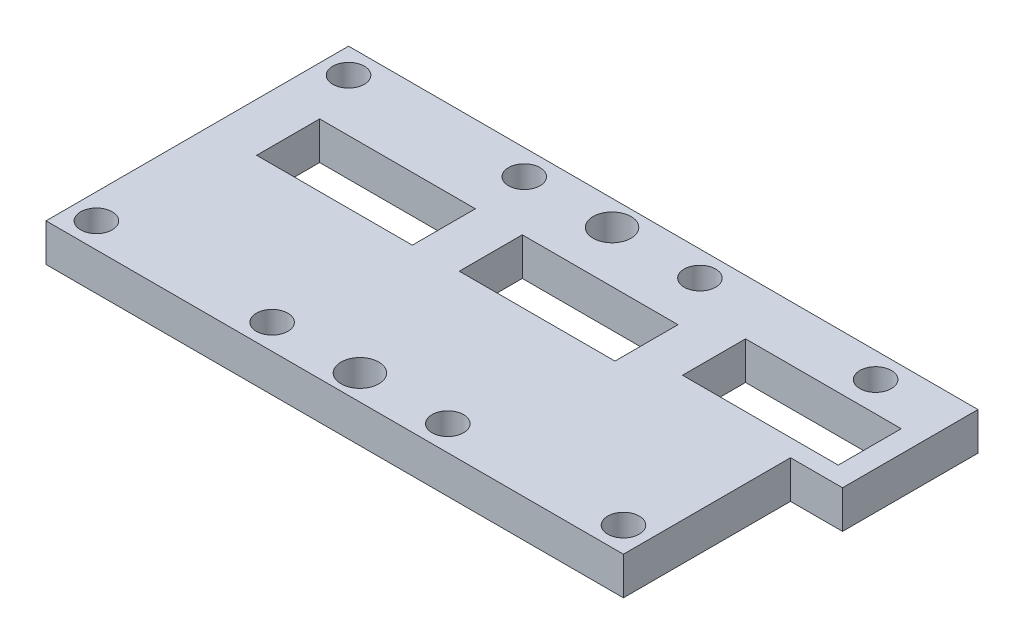
from build123d import *

# Parameters (mm, degrees)
SKETCH1_W           = 229
SKETCH1_H           = 120
BOSS_EXTRUDE1_DEPTH = 15
SKETCH2_W           = 20.632503002
SKETCH2_H           = 53.730004003
BOSS_EXTRUDE2_DEPTH = 15
CUT_EXTRUDE1_REACH  = 239.205
SKETCH3_W           = 61.75
SKETCH3_H           = 25
CUT_EXTRUDE2_REACH  = 239.205
SKETCH4_W           = 61.75
SKETCH4_H           = 25
CUT_EXTRUDE3_REACH  = 239.205
SKETCH5_W           = 61.75
SKETCH5_H           = 25
CUT_EXTRUDE5_REACH  = 239.205
SKETCH7_R           = 7.5
CUT_EXTRUDE7_REACH  = 239.205
SKETCH14_R          = 6.25


with BuildPart() as part:
    # Sketch1 → Boss-Extrude1 (new body)
    with BuildSketch(Plane(origin=(0, 0, 0), x_dir=(1, 0, 0), z_dir=(0, 1, 0))):
        with Locations((-114.5, 0)):
            Rectangle(SKETCH1_W, SKETCH1_H)
    extrude(amount=-BOSS_EXTRUDE1_DEPTH)

    # Sketch2 → Boss-Extrude2 (add)
    with BuildSketch(Plane(origin=(0, 0, 0), x_dir=(1, 0, 0), z_dir=(0, 1, 0))):
        with Locations((10.316251501, 33.134997999)):
            Rectangle(SKETCH2_W, SKETCH2_H)
    extrude(amount=-BOSS_EXTRUDE2_DEPTH)

    # Sketch3 → Cut-Extrude1 (cut, up to next)
    with BuildSketch(Plane(origin=(0, 0, 0), x_dir=(1, 0, 0), z_dir=(0, 1, 0)), mode=Mode.PRIVATE) as cut_extrude1_sk1:
        with Locations((-18.875, 25.691000385)):
            Rectangle(SKETCH3_W, SKETCH3_H)
    cut_extrude1_tool1 = extrude(cut_extrude1_sk1.sketch, amount=-CUT_EXTRUDE1_REACH, mode=Mode.PRIVATE) & part.part
    add(cut_extrude1_tool1.solids().sort_by_distance((-18.875, 0, -25.691))[0], mode=Mode.SUBTRACT)

    # Sketch4 → Cut-Extrude2 (cut, up to next)
    with BuildSketch(Plane(origin=(0, 0, 0), x_dir=(1, 0, 0), z_dir=(0, 1, 0)), mode=Mode.PRIVATE) as cut_extrude2_sk1:
        with Locations((-98.875, 17.152366083)):
            Rectangle(SKETCH4_W, SKETCH4_H)
    cut_extrude2_tool1 = extrude(cut_extrude2_sk1.sketch, amount=-CUT_EXTRUDE2_REACH, mode=Mode.PRIVATE) & part.part
    add(cut_extrude2_tool1.solids().sort_by_distance((-98.875, 0, -17.152366))[0], mode=Mode.SUBTRACT)

    # Sketch5 → Cut-Extrude3 (cut, up to next)
    with BuildSketch(Plane(origin=(0, 0, 0), x_dir=(1, 0, 0), z_dir=(0, 1, 0)), mode=Mode.PRIVATE) as cut_extrude3_sk1:
        with Locations((-178.875, 16.78)):
            Rectangle(SKETCH5_W, SKETCH5_H)
    cut_extrude3_tool1 = extrude(cut_extrude3_sk1.sketch, amount=-CUT_EXTRUDE3_REACH, mode=Mode.PRIVATE) & part.part
    add(cut_extrude3_tool1.solids().sort_by_distance((-178.875, 0, -16.78))[0], mode=Mode.SUBTRACT)

    # Sketch7 → Cut-Extrude5 (cut, up to next)
    with BuildSketch(Plane(origin=(0, 0, 0), x_dir=(1, 0, 0), z_dir=(0, 1, 0)), mode=Mode.PRIVATE) as cut_extrude5_sk1:
        with Locations(Location((-114.5, 50, 0), (0, 0, 270))):
            Circle(SKETCH7_R)
    cut_extrude5_tool1 = extrude(cut_extrude5_sk1.sketch, amount=-CUT_EXTRUDE5_REACH, mode=Mode.PRIVATE) & part.part
    # Sketch7 → Cut-Extrude5 (cut, up to next)
    with BuildSketch(Plane(origin=(0, 0, 0), x_dir=(1, 0, 0), z_dir=(0, 1, 0)), mode=Mode.PRIVATE) as cut_extrude5_sk2:
        with Locations(Location((-114.5, -50, 0), (0, 0, 270))):
            Circle(SKETCH7_R)
    cut_extrude5_tool2 = extrude(cut_extrude5_sk2.sketch, amount=-CUT_EXTRUDE5_REACH, mode=Mode.PRIVATE) & part.part
    add(cut_extrude5_tool1.solids().sort_by_distance((-114.5, 0, -50))[0], mode=Mode.SUBTRACT)
    add(cut_extrude5_tool2.solids().sort_by_distance((-114.5, 0, 50))[0], mode=Mode.SUBTRACT)

    # Sketch14 → Cut-Extrude7 (cut, up to next)
    with BuildSketch(Plane(origin=(0, 0, 0), x_dir=(1, 0, 0), z_dir=(0, 1, 0)), mode=Mode.PRIVATE) as cut_extrude7_sk1:
        with Locations(Location((-219, 50, 0), (0, 0, 270))):
            Circle(SKETCH14_R)
    cut_extrude7_tool1 = extrude(cut_extrude7_sk1.sketch, amount=-CUT_EXTRUDE7_REACH, mode=Mode.PRIVATE) & part.part
    # Sketch14 → Cut-Extrude7 (cut, up to next)
    with BuildSketch(Plane(origin=(0, 0, 0), x_dir=(1, 0, 0), z_dir=(0, 1, 0)), mode=Mode.PRIVATE) as cut_extrude7_sk2:
        with Locations(Location((-219, -50, 0), (0, 0, 270))):
            Circle(SKETCH14_R)
    cut_extrude7_tool2 = extrude(cut_extrude7_sk2.sketch, amount=-CUT_EXTRUDE7_REACH, mode=Mode.PRIVATE) & part.part
    # Sketch14 → Cut-Extrude7 (cut, up to next)
    with BuildSketch(Plane(origin=(0, 0, 0), x_dir=(1, 0, 0), z_dir=(0, 1, 0)), mode=Mode.PRIVATE) as cut_extrude7_sk3:
        with Locations(Location((-149.323, -50, 0), (0, 0, 270))):
            Circle(SKETCH14_R)
    cut_extrude7_tool3 = extrude(cut_extrude7_sk3.sketch, amount=-CUT_EXTRUDE7_REACH, mode=Mode.PRIVATE) & part.part
    # Sketch14 → Cut-Extrude7 (cut, up to next)
    with BuildSketch(Plane(origin=(0, 0, 0), x_dir=(1, 0, 0), z_dir=(0, 1, 0)), mode=Mode.PRIVATE) as cut_extrude7_sk4:
        with Locations(Location((-79.646, -50, 0), (0, 0, 270))):
            Circle(SKETCH14_R)
    cut_extrude7_tool4 = extrude(cut_extrude7_sk4.sketch, amount=-CUT_EXTRUDE7_REACH, mode=Mode.PRIVATE) & part.part
    # Sketch14 → Cut-Extrude7 (cut, up to next)
    with BuildSketch(Plane(origin=(0, 0, 0), x_dir=(1, 0, 0), z_dir=(0, 1, 0)), mode=Mode.PRIVATE) as cut_extrude7_sk5:
        with Locations(Location((-9.969, -50, 0), (0, 0, 270))):
            Circle(SKETCH14_R)
    cut_extrude7_tool5 = extrude(cut_extrude7_sk5.sketch, amount=-CUT_EXTRUDE7_REACH, mode=Mode.PRIVATE) & part.part
    # Sketch14 → Cut-Extrude7 (cut, up to next)
    with BuildSketch(Plane(origin=(0, 0, 0), x_dir=(1, 0, 0), z_dir=(0, 1, 0)), mode=Mode.PRIVATE) as cut_extrude7_sk6:
        with Locations(Location((-9.969, 50, 0), (0, 0, 270))):
            Circle(SKETCH14_R)
    cut_extrude7_tool6 = extrude(cut_extrude7_sk6.sketch, amount=-CUT_EXTRUDE7_REACH, mode=Mode.PRIVATE) & part.part
    # Sketch14 → Cut-Extrude7 (cut, up to next)
    with BuildSketch(Plane(origin=(0, 0, 0), x_dir=(1, 0, 0), z_dir=(0, 1, 0)), mode=Mode.PRIVATE) as cut_extrude7_sk7:
        with Locations(Location((-79.646, 50, 0), (0, 0, 270))):
            Circle(SKETCH14_R)
    cut_extrude7_tool7 = extrude(cut_extrude7_sk7.sketch, amount=-CUT_EXTRUDE7_REACH, mode=Mode.PRIVATE) & part.part
    # Sketch14 → Cut-Extrude7 (cut, up to next)
    with BuildSketch(Plane(origin=(0, 0, 0), x_dir=(1, 0, 0), z_dir=(0, 1, 0)), mode=Mode.PRIVATE) as cut_extrude7_sk8:
        with Locations(Location((-149.323, 50, 0), (0, 0, 270))):
            Circle(SKETCH14_R)
    cut_extrude7_tool8 = extrude(cut_extrude7_sk8.sketch, amount=-CUT_EXTRUDE7_REACH, mode=Mode.PRIVATE) & part.part
    add(cut_extrude7_tool1.solids().sort_by_distance((-219, 0, -50))[0], mode=Mode.SUBTRACT)
    add(cut_extrude7_tool2.solids().sort_by_distance((-219, 0, 50))[0], mode=Mode.SUBTRACT)
    add(cut_extrude7_tool3.solids().sort_by_distance((-149.323, 0, 50))[0], mode=Mode.SUBTRACT)
    add(cut_extrude7_tool4.solids().sort_by_distance((-79.646, 0, 50))[0], mode=Mode.SUBTRACT)
    add(cut_extrude7_tool5.solids().sort_by_distance((-9.969, 0, 50))[0], mode=Mode.SUBTRACT)
    add(cut_extrude7_tool6.solids().sort_by_distance((-9.969, 0, -50))[0], mode=Mode.SUBTRACT)
    add(cut_extrude7_tool7.solids().sort_by_distance((-79.646, 0, -50))[0], mode=Mode.SUBTRACT)
    add(cut_extrude7_tool8.solids().sort_by_distance((-149.323, 0, -50))[0], mode=Mode.SUBTRACT)


solid = part.part
